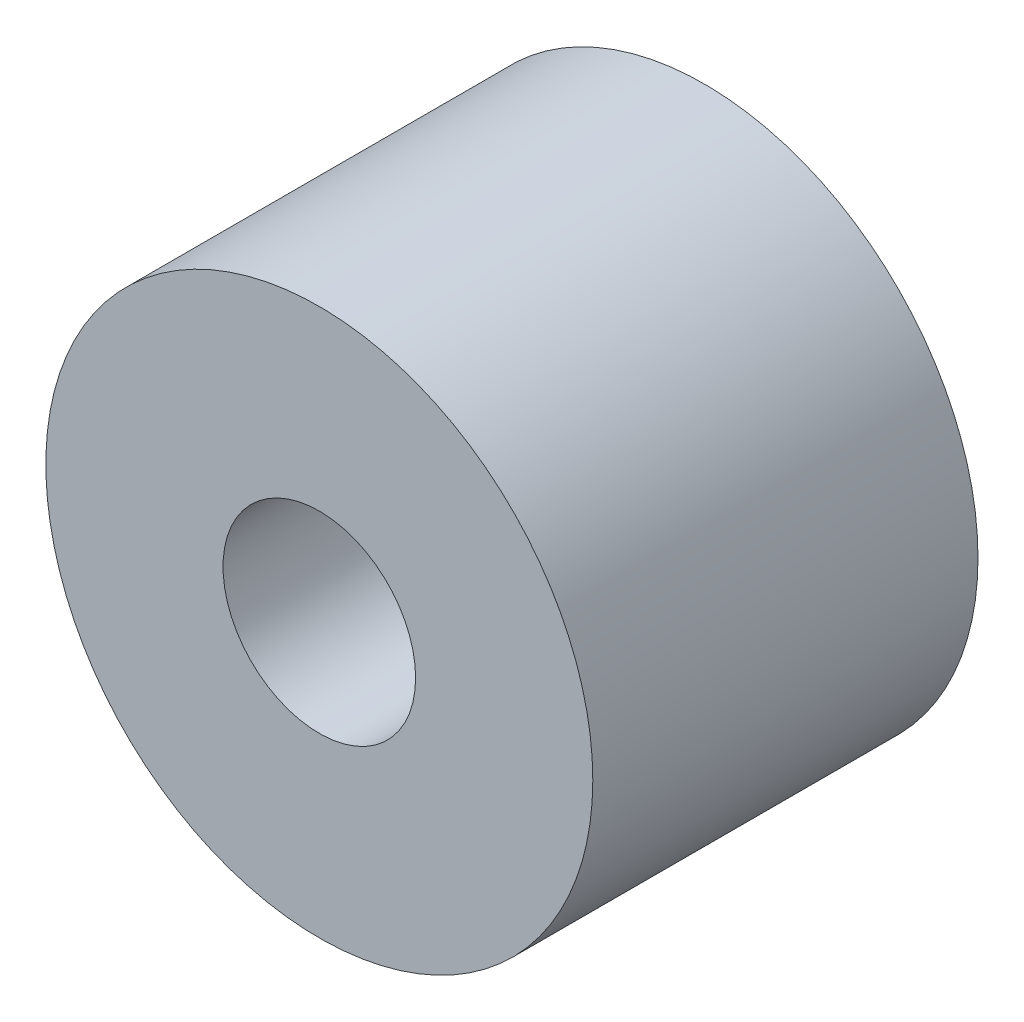
from build123d import *

# Parameters (mm, degrees)
SKETCH1_R                                      = 14.2
SKETCH1_R_2                                    = 5
CONNECTION_SPACE_ONLY_NO_THREADS_OR_SEAL_DEPTH = 20


with BuildPart() as part:
    # Sketch1 → Connection_space_only_NO_THREADS_OR_SEALS (new body)
    with BuildSketch(Plane.XY):
        Circle(SKETCH1_R)
        Circle(SKETCH1_R_2, mode=Mode.SUBTRACT)
    extrude(amount=CONNECTION_SPACE_ONLY_NO_THREADS_OR_SEAL_DEPTH)


solid = part.part
